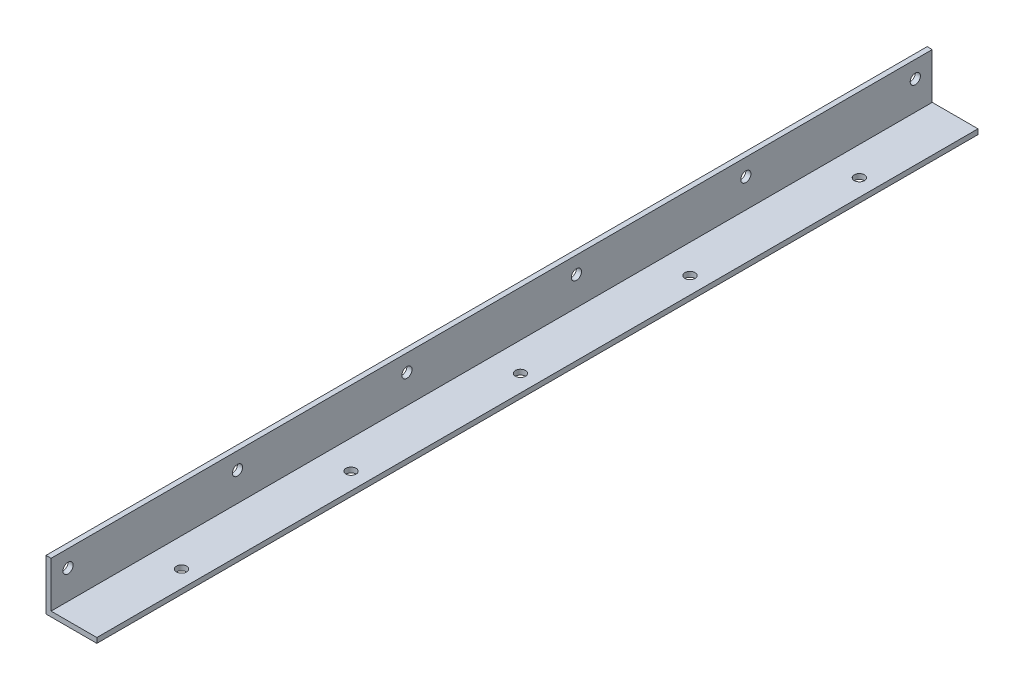
from build123d import *

# Parameters (mm, degrees)
EXTRUSION1_DEPTH           = 260
ESQUISSE2_R                = 1.5
EXTRUSION2_DEPTH           = 261.863949215
R_P_TITION_LIN_AIRE1_COUNT = 6
R_P_TITION_LIN_AIRE1_PITCH = 50
ESQUISSE3_R                = 1.5
EXTRUSION3_DEPTH           = 261.863949215
R_P_TITION_LIN_AIRE2_COUNT = 5
R_P_TITION_LIN_AIRE2_PITCH = 50


with BuildPart() as part:
    # Esquisse1 → Extrusion1 (new body)
    with BuildSketch(Plane.XY):
        Polygon((0, 0), (1.5, 0), (15, 0), (15, 1.5), (1.5, 1.5), (1.5, 15), (0, 15), align=None)
    extrude(amount=EXTRUSION1_DEPTH)

    # Esquisse2 → Extrusion2 (cut, through all)
    with BuildSketch(Plane.ZY):
        with Locations((5, 10)):
            Circle(ESQUISSE2_R)
    extrusion2 = extrude(amount=-EXTRUSION2_DEPTH, mode=Mode.SUBTRACT)

    # Répétition linéaire1: Extrusion2 ×6
    with Locations(*[(0, 0, i * R_P_TITION_LIN_AIRE1_PITCH) for i in range(1, R_P_TITION_LIN_AIRE1_COUNT)]):
        add(extrusion2, mode=Mode.SUBTRACT)

    # Esquisse3 → Extrusion3 (cut, through all)
    with BuildSketch(Plane.XZ):
        with Locations(Location((10, 30, 0), (0, 0, 270))):
            Circle(ESQUISSE3_R)
    extrusion3 = extrude(amount=-EXTRUSION3_DEPTH, mode=Mode.SUBTRACT)

    # Répétition linéaire2: Extrusion3 ×5
    with Locations(*[(0, 0, i * R_P_TITION_LIN_AIRE2_PITCH) for i in range(1, R_P_TITION_LIN_AIRE2_COUNT)]):
        add(extrusion3, mode=Mode.SUBTRACT)


solid = part.part
